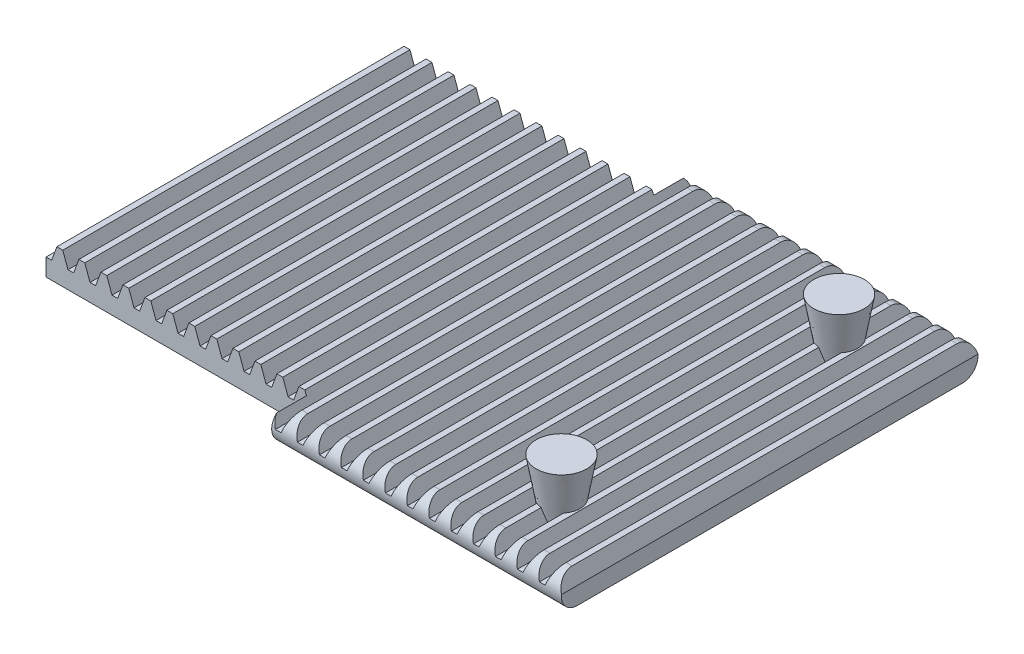
from build123d import *

# Parameters (mm, degrees)
BOSS_EXTRUDE1_DEPTH           = 24
SKETCH6_W                     = 30
SKETCH6_H                     = 4
CUT_EXTRUDE2_DEPTH            = 286.642446166
CUT_EXTRUDE1_DEPTH            = 242.081568844
SKETCH7_R                     = 1.5
BOSS_EXTRUDE2_DEPTH           = 8
BOSS_EXTRUDE2_DRAFT           = 10
BOSS_EXTRUDE2_PROFILE_2_DEPTH = 8
BOSS_EXTRUDE2_PROFILE_2_DRAFT = 10


with BuildPart() as part:
    # Sketch4 → Boss-Extrude1 (new, symmetric)
    with BuildSketch(Plane(origin=(-229.78233317, -228.51233317, 0), x_dir=(0, 1, 0), z_dir=(0, 0, 1))):
        Polygon((-0.84773851, -8.551941602), (0.807370009, -7.949531351), (0.807370009, -7.269034775), (-0.84773851, -6.666624604), (-0.84773851, -6.01679977), (0.807370009, -5.414389518), (0.807370009, -4.733892942), (-0.84773851, -4.131482772), (-0.84773851, -3.481657937), (0.807370009, -2.879247686), (0.807370009, -2.19875111), (-0.84773851, -1.596340939), (-0.84773851, -0.946516105), (0.807370009, -0.344105854), (0.807370009, 0.336390722), (-0.84773851, 0.938800893), (-0.84773851, 1.588625727), (0.807370009, 2.191035978), (0.807370009, 2.871532554), (-0.84773851, 3.473942725), (-0.84773851, 4.123767559), (0.807370009, 4.726177811), (0.807370009, 5.406674387), (-0.84773851, 6.009084557), (-0.84773851, 6.658909392), (0.807370009, 7.261319643), (0.807370009, 7.941816219), (-0.84773851, 8.54422639), (-0.84773851, 9.194051224), (0.807370009, 9.796461475), (0.807370009, 10.476958051), (-0.84773851, 11.079368222), (-0.84773851, 11.729193056), (0.807370009, 12.331603308), (0.807370009, 13.012099883), (-0.84773851, 13.614510054), (-0.84773851, 14.264334888), (0.807370009, 14.86674514), (0.807370009, 15.547241716), (-0.84773851, 16.149651886), (-0.84773851, 16.799476721), (0.807370009, 17.401886972), (0.807370009, 18.082383548), (-0.84773851, 18.684793719), (-0.84773851, 19.334618553), (0.807370009, 19.937028804), (0.807370009, 20.61752538), (-0.84773851, 21.219935551), (-0.84773851, 21.869760385), (0.807370009, 22.472170637), (0.807370009, 23.152667212), (-0.84773851, 23.755077383), (-0.84773851, 24.404902217), (0.807370009, 25.007312469), (0.807370009, 25.687809045), (-0.84773851, 26.290219215), (-0.84773851, 26.94004405), (0.807370009, 27.542454301), (0.807370009, 28.222950877), (-0.84773851, 28.825361048), (-0.84773851, 29.475185882), (0.807370009, 30.077596133), (0.807370009, 30.758092709), (-0.84773851, 31.36050288), (-0.84773851, 32.010327714), (0.807370009, 32.612737966), (0.807370009, 33.293234541), (-0.84773851, 33.895644712), (-0.84773851, 34.545469546), (0.807370009, 35.147879798), (0.807370009, 35.828376374), (-0.84773851, 36.430786544), (-0.84773851, 37.080611379), (0.807370009, 37.68302163), (0.807370009, 38.363518206), (-0.84773851, 38.965928377), (-0.84773851, 39.615753211), (0.807370009, 40.218163462), (0.807370009, 40.898660038), (-0.84773851, 41.501070209), (-0.84773851, 42.150895043), (0.807370009, 42.753305295), (0.807370009, 43.43380187), (-0.84773851, 44.036212041), (-0.84773851, 44.686036875), (0.807370009, 45.288447127), (0.807370009, 45.968943703), (-0.84773851, 46.571353873), (-0.84773851, 47.221178708), (0.807370009, 47.823588959), (0.807370009, 48.504085535), (-0.84773851, 49.106495706), (-0.84773851, 49.75632054), (0.807370009, 50.358730791), (0.807370009, 51.039227367), (-0.84773851, 51.641637538), (-0.84773851, 52.291462372), (0.807370009, 52.893872624), (0.807370009, 53.574369199), (-0.84773851, 54.17677937), (-0.84773851, 54.826604204), (-2.84773851, 54.826604204), (-2.84773851, -8.551941602), align=None)
    extrude(amount=BOSS_EXTRUDE1_DEPTH, both=True)

    # Sketch6 → Cut-Extrude2 (cut, through all)
    with BuildSketch(Plane.XZ.offset(231.36007168)):
        with Locations((-269.608937374, -22)):
            Rectangle(SKETCH6_W, SKETCH6_H)
        with Locations((-269.608937374, 22)):
            Rectangle(SKETCH6_W, SKETCH6_H)
    extrude(amount=-CUT_EXTRUDE2_DEPTH, mode=Mode.SUBTRACT)

    # Sketch5 → Cut-Extrude1 (cut, through all)
    with BuildSketch(Plane(origin=(-221.230391568, 0, 0), x_dir=(0, 0, -1), z_dir=(1, 0, 0))):
        with BuildLine():
            Line((-22.17244574, -227.704963161), (-22.17244574, -227.204963161))
            Line((-22.17244574, -227.204963161), (-24.67244574, -227.204963161))
            Line((-24.67244574, -227.204963161), (-24.67244574, -231.86007168))
            Line((-24.67244574, -231.86007168), (-22.17244574, -231.86007168))
            Line((-22.17244574, -231.86007168), (-22.17244574, -231.36007168))
            ThreePointArc((-22.17244574, -231.36007168), (-24, -229.53251742), (-22.17244574, -227.704963161))
        make_face()
        with BuildLine():
            Line((22.17244574, -231.86007168), (22.17244574, -231.36007168))
            ThreePointArc((22.17244574, -231.36007168), (24, -229.53251742), (22.17244574, -227.704963161))
            Line((22.17244574, -227.704963161), (22.17244574, -227.204963161))
            Line((22.17244574, -227.204963161), (24.67244574, -227.204963161))
            Line((24.67244574, -227.204963161), (24.67244574, -231.86007168))
            Line((24.67244574, -231.86007168), (22.17244574, -231.86007168))
        make_face()
    extrude(amount=-CUT_EXTRUDE1_DEPTH, mode=Mode.SUBTRACT)


with BuildPart() as boss_extrude2_tool:
    # Sketch7 → Boss-Extrude2 (with draft: the straight prism first)
    with BuildSketch(Plane.XZ.offset(231.36007168)):
        with Locations((-229.230391568, -15.991845927)):
            Circle(SKETCH7_R)
    extrude(amount=-BOSS_EXTRUDE2_DEPTH)
    # Boss-Extrude2: the draft: its side faces are tilted about the plane it starts from
    boss_extrude2_sides = [boss_extrude2_tool.faces().sort_by_distance(p)[0] for p in [
        (-230.730391568, -227.36007168, -15.991845927),
    ]]
    draft(boss_extrude2_sides, Plane.XZ.offset(231.36007168), BOSS_EXTRUDE2_DRAFT)


with BuildPart() as part_1:
    add(part.part)

    # Boss-Extrude2: add boss_extrude2_tool
    add(boss_extrude2_tool.part)


with BuildPart() as boss_extrude2_profile_2_tool:
    # Sketch7 → Boss-Extrude2 profile 2 (with draft: the straight prism first)
    with BuildSketch(Plane.XZ.offset(231.36007168)):
        with Locations((-229.230391568, 15.991845927)):
            Circle(SKETCH7_R)
    extrude(amount=-BOSS_EXTRUDE2_PROFILE_2_DEPTH)
    # Boss-Extrude2 profile 2: the draft: its side faces are tilted about the plane it starts from
    boss_extrude2_profile_2_sides = [boss_extrude2_profile_2_tool.faces().sort_by_distance(p)[0] for p in [
        (-230.730391568, -227.36007168, 15.991845927),
    ]]
    draft(boss_extrude2_profile_2_sides, Plane.XZ.offset(231.36007168), BOSS_EXTRUDE2_PROFILE_2_DRAFT)


with BuildPart() as part_2:
    add(part_1.part)

    # Boss-Extrude2 profile 2: add boss_extrude2_profile_2_tool
    add(boss_extrude2_profile_2_tool.part)


solid = part_2.part
